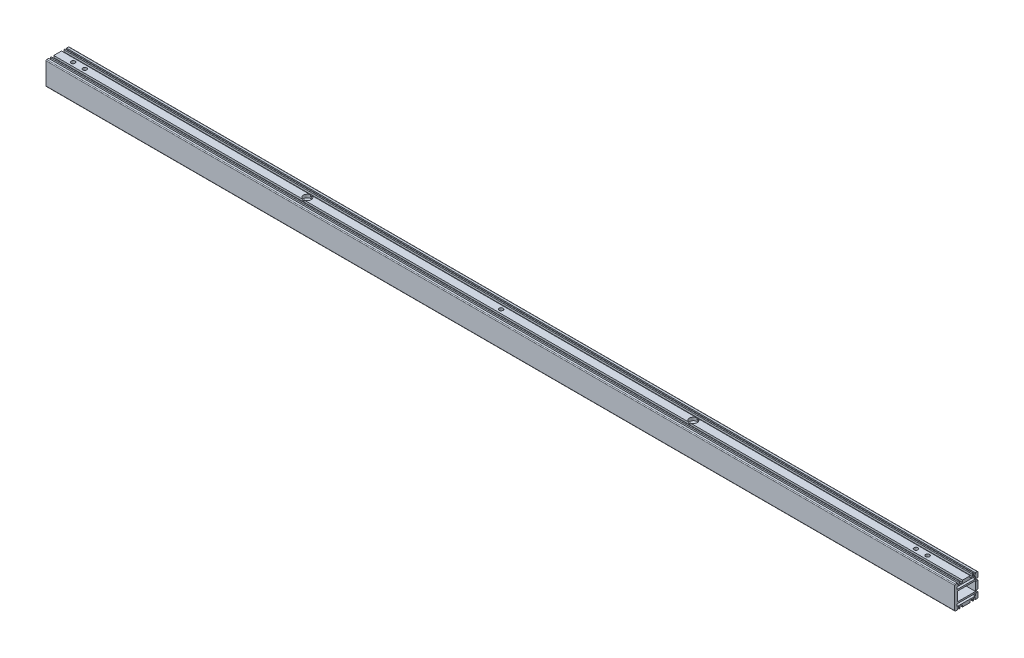
from build123d import *

# Parameters (mm, degrees)
SKETCH_1_W             = 23.5
SKETCH_1_H             = 12
EXTRUDE_1_DEPTH        = 586
HOLE_WIZARD_M6_1_D     = 5
HOLE_WIZARD_M6_1_DEPTH = 15
HOLE_WIZARD_M6_1_TIP   = 1.502151548
HOLE_WIZARD_M6_2_D     = 5
HOLE_WIZARD_M6_2_DEPTH = 15
HOLE_WIZARD_M6_2_TIP   = 1.502151548
HOLE_WIZARD_M6_3_D     = 5
HOLE_WIZARD_M6_3_DEPTH = 15
HOLE_WIZARD_M6_3_TIP   = 1.502151548
SKETCH_10_R            = 5.05
CUT_EXTRUDE_1_DEPTH    = 587.959112716
HOLE_WIZARD_M4_1_D     = 3.3
HOLE_WIZARD_M4_1_DEPTH = 10.1
HOLE_WIZARD_M4_1_TIP   = 0.991420021
HOLE_WIZARD_M4_2_D     = 3.3
HOLE_WIZARD_M4_2_DEPTH = 10.1
HOLE_WIZARD_M4_2_TIP   = 0.991420021
HOLE_WIZARD_M4_3_D     = 3.3
HOLE_WIZARD_M4_3_DEPTH = 10.1
HOLE_WIZARD_M4_3_TIP   = 0.991420021
HOLE_WIZARD_M6_4_D     = 5
HOLE_WIZARD_M6_4_DEPTH = 15
HOLE_WIZARD_M6_4_TIP   = 1.502151548


with BuildPart() as part:
    # 草图1 → 凸台-拉伸1 (new, symmetric)
    with BuildSketch(Plane(origin=(0, 0, 0), x_dir=(0, 0, -1), z_dir=(1, 0, 0))):
        with BuildLine():
            Line((-14, 15), (-11.5, 15))
            Line((-11.5, 15), (-11.5, 13.5))
            Line((-11.5, 13.5), (-11.4, 13.5))
            ThreePointArc((-11.4, 13.5), (-11.117157288, 13.382842712), (-11, 13.1))
            Line((-11, 13.1), (-11, 12))
            Line((-11, 12), (-9.5, 12))
            Line((-9.5, 12), (-9.5, 15))
            Line((-9.5, 15), (-8, 15))
            Line((-8, 15), (-8, 12.5))
            Line((-8, 12.5), (-5, 12.5))
            Line((-5, 12.5), (-5, 15))
            Line((-5, 15), (5, 15))
            Line((5, 15), (5, 12.5))
            Line((5, 12.5), (8, 12.5))
            Line((8, 12.5), (8, 15))
            Line((8, 15), (9.5, 15))
            Line((9.5, 15), (9.5, 12))
            Line((9.5, 12), (11, 12))
            Line((11, 12), (11, 13.1))
            ThreePointArc((11, 13.1), (11.117157288, 13.382842712), (11.4, 13.5))
            Line((11.4, 13.5), (11.5, 13.5))
            Line((11.5, 13.5), (11.5, 15))
            Line((11.5, 15), (14, 15))
            ThreePointArc((14, 15), (14.707106781, 14.707106781), (15, 14))
            Line((15, 14), (15, 8))
            Line((15, 8), (12.5, 8))
            Line((12.5, 8), (12.5, 5))
            Line((12.5, 5), (15, 5))
            Line((15, 5), (15, -5))
            Line((15, -5), (12.5, -5))
            Line((12.5, -5), (12.5, -8))
            Line((12.5, -8), (15, -8))
            Line((15, -8), (15, -14))
            ThreePointArc((15, -14), (14.707106781, -14.707106781), (14, -15))
            Line((14, -15), (11.5, -15))
            Line((11.5, -15), (11.5, -13.5))
            Line((11.5, -13.5), (11.4, -13.5))
            ThreePointArc((11.4, -13.5), (11.117157288, -13.382842712), (11, -13.1))
            Line((11, -13.1), (11, -12))
            Line((11, -12), (9.5, -12))
            Line((9.5, -12), (9.5, -15))
            Line((9.5, -15), (8, -15))
            Line((8, -15), (8, -12.5))
            Line((8, -12.5), (5, -12.5))
            Line((5, -12.5), (5, -15))
            Line((5, -15), (-5, -15))
            Line((-5, -15), (-5, -12.5))
            Line((-5, -12.5), (-8, -12.5))
            Line((-8, -12.5), (-8, -15))
            Line((-8, -15), (-9.5, -15))
            Line((-9.5, -15), (-9.5, -12))
            Line((-9.5, -12), (-11, -12))
            Line((-11, -12), (-11, -13.1))
            ThreePointArc((-11, -13.1), (-11.117157288, -13.382842712), (-11.4, -13.5))
            Line((-11.4, -13.5), (-11.5, -13.5))
            Line((-11.5, -13.5), (-11.5, -15))
            Line((-11.5, -15), (-14, -15))
            ThreePointArc((-14, -15), (-14.707106781, -14.707106781), (-15, -14))
            Line((-15, -14), (-15, 14))
            ThreePointArc((-15, 14), (-14.707106781, 14.707106781), (-14, 15))
        make_face()
        with BuildLine():
            Line((12, -10.5), (12, -8.5))
            ThreePointArc((12, -8.5), (11.853553391, -8.146446609), (11.5, -8))
            Line((11.5, -8), (-11.5, -8))
            ThreePointArc((-11.5, -8), (-11.853553391, -8.146446609), (-12, -8.5))
            Line((-12, -8.5), (-12, -10.5))
            ThreePointArc((-12, -10.5), (-11.853553391, -10.853553391), (-11.5, -11))
            Line((-11.5, -11), (11.5, -11))
            ThreePointArc((11.5, -11), (11.853553391, -10.853553391), (12, -10.5))
        make_face(mode=Mode.SUBTRACT)
        with BuildLine():
            Line((-11.5, 11), (11.5, 11))
            ThreePointArc((11.5, 11), (11.853553391, 10.853553391), (12, 10.5))
            Line((12, 10.5), (12, 8.5))
            ThreePointArc((12, 8.5), (11.853553391, 8.146446609), (11.5, 8))
            Line((11.5, 8), (-11.5, 8))
            ThreePointArc((-11.5, 8), (-11.853553391, 8.146446609), (-12, 8.5))
            Line((-12, 8.5), (-12, 10.5))
            ThreePointArc((-12, 10.5), (-11.853553391, 10.853553391), (-11.5, 11))
        make_face(mode=Mode.SUBTRACT)
        Rectangle(SKETCH_1_W, SKETCH_1_H, mode=Mode.SUBTRACT)
    extrude(amount=EXTRUDE_1_DEPTH, both=True)

    # M6 螺纹孔1
    with Locations(Plane.XZ.offset(15)):
        with Locations((-566, 0), (-551, 0), (184, 0), (199, 0)):
            Hole(HOLE_WIZARD_M6_1_D / 2, depth=HOLE_WIZARD_M6_1_DEPTH)
            with Locations((0, 0, -(HOLE_WIZARD_M6_1_DEPTH + HOLE_WIZARD_M6_1_TIP / 2))):  # 118° drill point
                Cone(0, HOLE_WIZARD_M6_1_D / 2, HOLE_WIZARD_M6_1_TIP, mode=Mode.SUBTRACT)

    # M6 螺纹孔2
    with Locations(Plane(origin=(0, 0, -15), x_dir=(-1, 0, 0), z_dir=(0, 0, -1))):
        with Locations((566, 0), (551, 0), (-521, 0), (-536, 0), (-448, 0), (-361, 0), (-344, 0)):
            Hole(HOLE_WIZARD_M6_2_D / 2, depth=HOLE_WIZARD_M6_2_DEPTH)
            with Locations((0, 0, -(HOLE_WIZARD_M6_2_DEPTH + HOLE_WIZARD_M6_2_TIP / 2))):  # 118° drill point
                Cone(0, HOLE_WIZARD_M6_2_D / 2, HOLE_WIZARD_M6_2_TIP, mode=Mode.SUBTRACT)

    # M6 螺纹孔3
    with Locations(Plane(origin=(0, 15, 0), x_dir=(-1, 0, 0), z_dir=(0, 1, 0))):
        with Locations((-536, 0), (-521, 0), (551, 0), (566, 0), (14, 0)):
            Hole(HOLE_WIZARD_M6_3_D / 2, depth=HOLE_WIZARD_M6_3_DEPTH)
            with Locations((0, 0, -(HOLE_WIZARD_M6_3_DEPTH + HOLE_WIZARD_M6_3_TIP / 2))):  # 118° drill point
                Cone(0, HOLE_WIZARD_M6_3_D / 2, HOLE_WIZARD_M6_3_TIP, mode=Mode.SUBTRACT)

    # 草图10 → 切除-拉伸1 (cut, through all)
    with BuildSketch(Plane(origin=(0, 15, 0), x_dir=(1, 0, 0), z_dir=(0, 1, 0))):
        with Locations(Location((234, 0, 0), (0, 0, 270))):
            Circle(SKETCH_10_R)
        with Locations(Location((-264, 0, 0), (0, 0, 270))):
            Circle(SKETCH_10_R)
    extrude(amount=-CUT_EXTRUDE_1_DEPTH, mode=Mode.SUBTRACT)

    # M4 螺纹孔1
    with Locations(Plane.XZ.offset(15)):
        with Locations((137, 0), (-23, 0), (-183, 0), (-343, 0), (-503, 0)):
            Hole(HOLE_WIZARD_M4_1_D / 2, depth=HOLE_WIZARD_M4_1_DEPTH)
            with Locations((0, 0, -(HOLE_WIZARD_M4_1_DEPTH + HOLE_WIZARD_M4_1_TIP / 2))):  # 118° drill point
                Cone(0, HOLE_WIZARD_M4_1_D / 2, HOLE_WIZARD_M4_1_TIP, mode=Mode.SUBTRACT)

    # M4 螺纹孔2
    with Locations(Plane.XZ.offset(15)):
        with Locations((461, 0), (261, 0)):
            Hole(HOLE_WIZARD_M4_2_D / 2, depth=HOLE_WIZARD_M4_2_DEPTH)
            with Locations((0, 0, -(HOLE_WIZARD_M4_2_DEPTH + HOLE_WIZARD_M4_2_TIP / 2))):  # 118° drill point
                Cone(0, HOLE_WIZARD_M4_2_D / 2, HOLE_WIZARD_M4_2_TIP, mode=Mode.SUBTRACT)

    # M4 螺纹孔3
    with Locations(Plane.XZ.offset(15)):
        with Locations((571, 0), (496, 0)):
            Hole(HOLE_WIZARD_M4_3_D / 2, depth=HOLE_WIZARD_M4_3_DEPTH)
            with Locations((0, 0, -(HOLE_WIZARD_M4_3_DEPTH + HOLE_WIZARD_M4_3_TIP / 2))):  # 118° drill point
                Cone(0, HOLE_WIZARD_M4_3_D / 2, HOLE_WIZARD_M4_3_TIP, mode=Mode.SUBTRACT)

    # M6 螺纹孔4
    with Locations(Plane(origin=(0, 0, -15), x_dir=(-1, 0, 0), z_dir=(0, 0, -1))):
        with Locations((-326, 0), (-266, 0), (296, 0), (356, 0)):
            Hole(HOLE_WIZARD_M6_4_D / 2, depth=HOLE_WIZARD_M6_4_DEPTH)
            with Locations((0, 0, -(HOLE_WIZARD_M6_4_DEPTH + HOLE_WIZARD_M6_4_TIP / 2))):  # 118° drill point
                Cone(0, HOLE_WIZARD_M6_4_D / 2, HOLE_WIZARD_M6_4_TIP, mode=Mode.SUBTRACT)


solid = part.part
